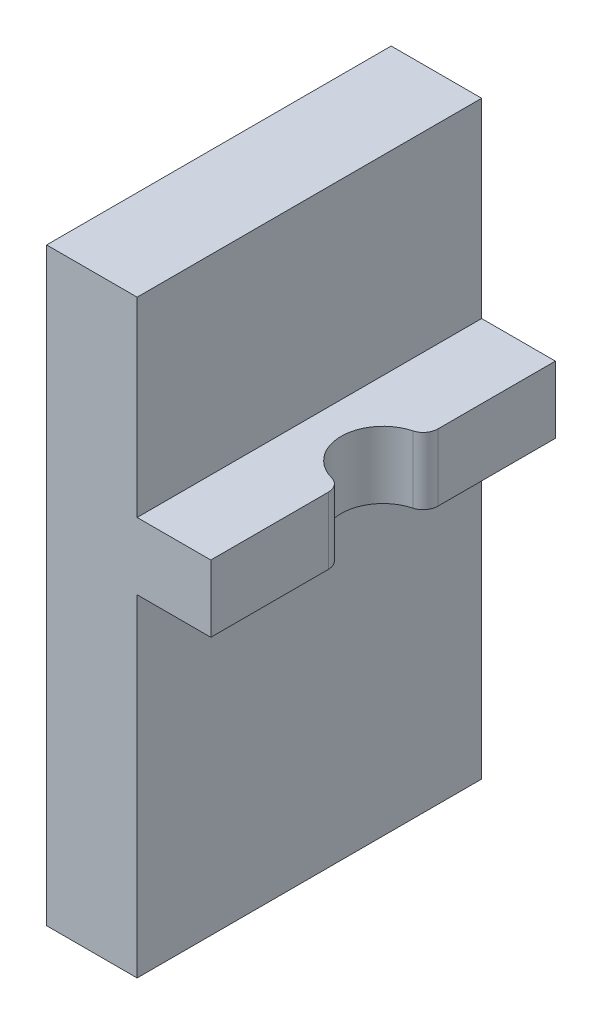
from build123d import *

# Parameters (mm, degrees)
SKETCH1_W           = 12.276797887
SKETCH1_H           = 46.74626888
BOSS_EXTRUDE1_DEPTH = 80
SKETCH8_W           = 46.74626888
SKETCH8_H           = 9.079638953
BOSS_EXTRUDE2_DEPTH = 10
CUT_EXTRUDE1_REACH  = 71.903
SKETCH10_R          = 5.704864585
FILLET1_R           = 2


with BuildPart() as part:
    # Sketch1 → Boss-Extrude1 (new body)
    with BuildSketch(Plane(origin=(0, 0, 0), x_dir=(1, 0, 0), z_dir=(0, 1, 0))):
        with Locations((-28.803256583, -3.777476273)):
            Rectangle(SKETCH1_W, SKETCH1_H)
    extrude(amount=BOSS_EXTRUDE1_DEPTH)

    # Sketch8 → Boss-Extrude2 (add)
    with BuildSketch(Plane(origin=(-22.664857639, 0, 0), x_dir=(0, 0, -1), z_dir=(1, 0, 0))):
        with Locations((-3.777476273, 49.574364566)):
            Rectangle(SKETCH8_W, SKETCH8_H)
    extrude(amount=BOSS_EXTRUDE2_DEPTH)

    # Sketch10 → Cut-Extrude1 (cut, up to next)
    with BuildSketch(Plane(origin=(0, 54.114184042, 0), x_dir=(1, 0, 0), z_dir=(0, 1, 0)), mode=Mode.PRIVATE) as cut_extrude1_sk1:
        with Locations((-12.664857639, -3.777476273)):
            Circle(SKETCH10_R)
    cut_extrude1_tool1 = extrude(cut_extrude1_sk1.sketch, amount=-CUT_EXTRUDE1_REACH, mode=Mode.PRIVATE) & part.part
    add(cut_extrude1_tool1.solids().sort_by_distance((-12.664858, 54.114184, 3.777476))[0], mode=Mode.SUBTRACT)

    # Fillet1
    fillet1_edges = [part.edges().sort_by_distance(p)[0] for p in [
        (-12.664857639, 49.574364566, -1.927388312),
        (-12.664857639, 49.574364566, 9.482340858),
    ]]
    fillet(fillet1_edges, radius=FILLET1_R)


solid = part.part
